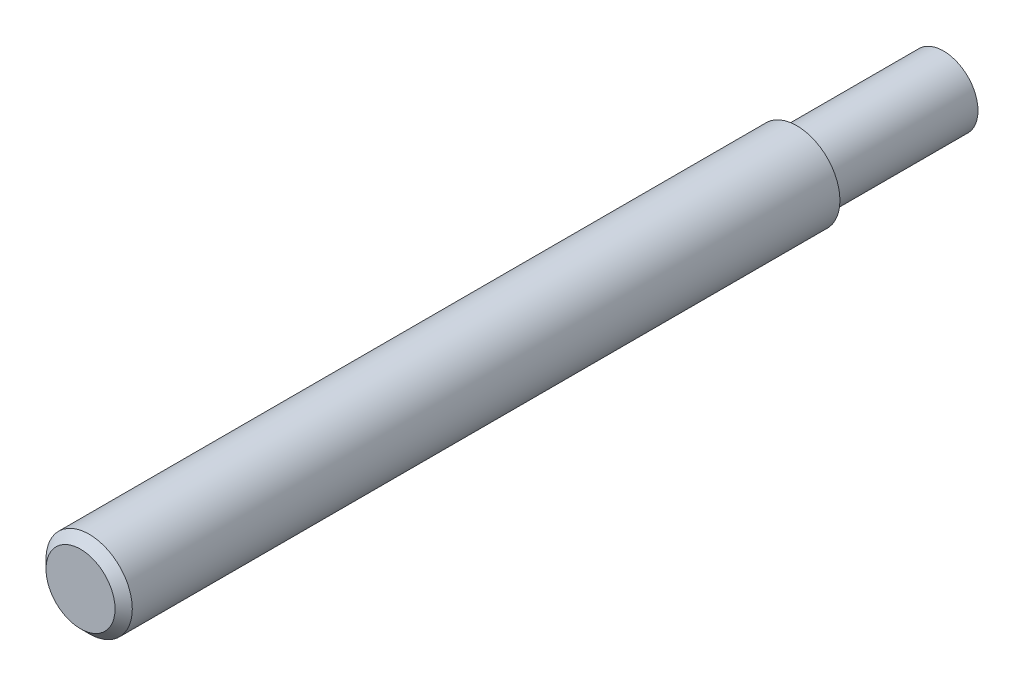
from build123d import *

# Parameters (mm, degrees)
ESQUISSE1_R                 = 4
BOSS_EXTRU_1_DEPTH          = 17
ESQUISSE2_R                 = 5
BOSS_EXTRU_2_DEPTH          = 83
CHANFREIN1_SIZE             = 1
TROU_TARAUD_M61_D           = 5
TROU_TARAUD_M61_DEPTH       = 15
TROU_TARAUD_M61_CSINK_D     = 7
TROU_TARAUD_M61_CSINK_ANGLE = 120
TROU_TARAUD_M61_TIP         = 1.502151548


with BuildPart() as part:
    # Esquisse1 → Boss.-Extru.1 (new body)
    with BuildSketch(Plane.XY):
        Circle(ESQUISSE1_R)
    extrude(amount=BOSS_EXTRU_1_DEPTH)

    # Esquisse2 → Boss.-Extru.2 (add)
    with BuildSketch(Plane.XY.offset(17)):
        Circle(ESQUISSE2_R)
    extrude(amount=BOSS_EXTRU_2_DEPTH)

    # Chanfrein1
    chanfrein1_edges = [part.edges().sort_by_distance(p)[0] for p in [
        (-5, 0, 100),
    ]]
    chamfer(chanfrein1_edges, length=CHANFREIN1_SIZE)

    # Trou taraudé M61
    with Locations(Plane(origin=(0, 0, 0), x_dir=(-1, 0, 0), z_dir=(0, 0, -1))):
        with Locations((0, 0)):
            CounterSinkHole(TROU_TARAUD_M61_D / 2, TROU_TARAUD_M61_CSINK_D / 2, depth=TROU_TARAUD_M61_DEPTH, counter_sink_angle=TROU_TARAUD_M61_CSINK_ANGLE)
            with Locations((0, 0, -(TROU_TARAUD_M61_DEPTH + TROU_TARAUD_M61_TIP / 2))):  # 118° drill point
                Cone(0, TROU_TARAUD_M61_D / 2, TROU_TARAUD_M61_TIP, mode=Mode.SUBTRACT)


solid = part.part
